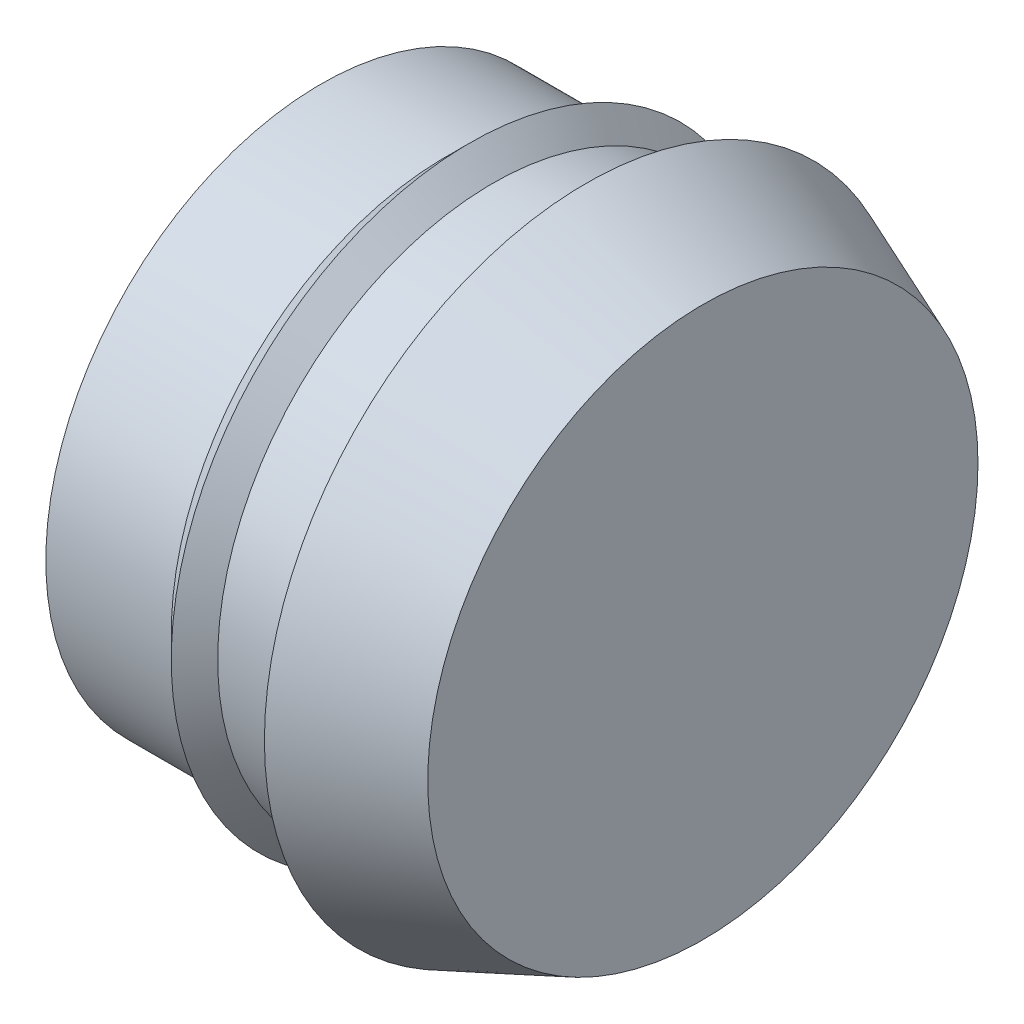
from build123d import *


with BuildPart() as part:
    # Sketch1 → Revolve1 (revolve)
    with BuildSketch(Plane(origin=(0, 0, 0), x_dir=(1, 0, 0), z_dir=(0, 1, 0))):
        Polygon((0, 0), (-13, 0), (-13, 9.365), (-8.73, 9.365), (-7.94, 10.155), (-7.15, 9.365), (-3.97, 9.365), (-3.97, 10.955), (0, 9.365), align=None)
    revolve(axis=Axis((0, 0, 0), (-1, 0, 0)))


solid = part.part
